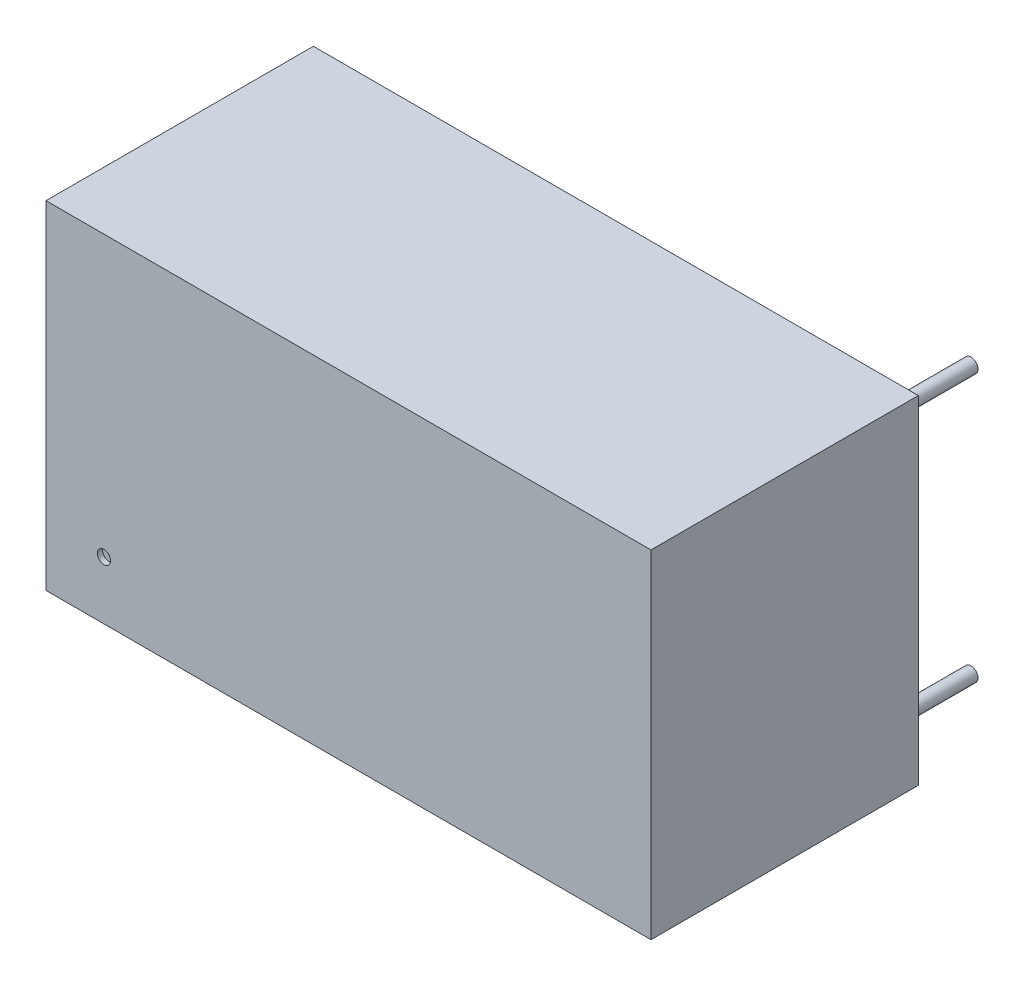
from build123d import *

# Parameters (mm, degrees)
SKIZZE1_W                       = 34.48
SKIZZE1_H                       = 19.24
AUFSATZ_LINEAR_AUSTRAGEN1_DEPTH = 15.24
SKIZZE2_R                       = 0.375
SCHNITT_LINEAR_AUSTRAGEN1_DEPTH = 0.3
SKIZZE3_R                       = 0.4
AUFSATZ_LINEAR_AUSTRAGEN2_DEPTH = 5


with BuildPart() as part:
    # Skizze1 → Aufsatz-Linear austragen1 (new body)
    with BuildSketch(Plane.XY):
        with Locations((17.24, 9.62)):
            Rectangle(SKIZZE1_W, SKIZZE1_H)
    extrude(amount=AUFSATZ_LINEAR_AUSTRAGEN1_DEPTH)

    # Skizze2 → Schnitt-Linear austragen1 (cut)
    with BuildSketch(Plane.XY.offset(15.24)):
        with Locations((3.3, 3.3)):
            Circle(SKIZZE2_R)
    extrude(amount=-SCHNITT_LINEAR_AUSTRAGEN1_DEPTH, mode=Mode.SUBTRACT)

    # Skizze3 → Aufsatz-Linear austragen2 (add)
    with BuildSketch(Plane(origin=(0, 0, 0), x_dir=(-1, 0, 0), z_dir=(0, 0, -1))):
        with Locations((-32.48, 17.24)):
            Circle(SKIZZE3_R)
        with Locations((-32.48, 2)):
            Circle(SKIZZE3_R)
        with Locations((-2, 12.16)):
            Circle(SKIZZE3_R)
        with Locations((-2, 7.08)):
            Circle(SKIZZE3_R)
    extrude(amount=AUFSATZ_LINEAR_AUSTRAGEN2_DEPTH)


solid = part.part
